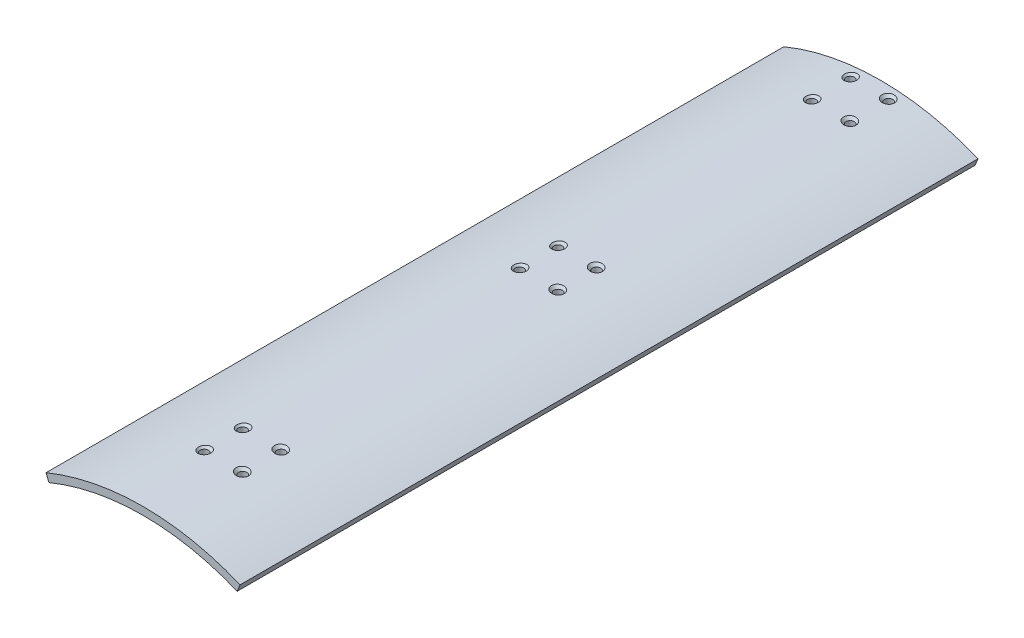
from build123d import *

# Parameters (mm, degrees)
BOSS_EXTRUDE1_DEPTH                               = 152.4
BOSS_EXTRUDE1_DEPTH_BACK                          = 152.4
CSK_FOR_4_FLAT_HEAD_MACHINE_SCREW_100_D           = 3.4544
CSK_FOR_4_FLAT_HEAD_MACHINE_SCREW_100_CSINK_D     = 5.715
CSK_FOR_4_FLAT_HEAD_MACHINE_SCREW_100_CSINK_ANGLE = 82


with BuildPart() as part:
    # Sketch1 → Boss-Extrude1 (new, two sides: drawn at the far end of the back side and taken through both)
    with BuildSketch(Plane.XY.offset(-BOSS_EXTRUDE1_DEPTH_BACK)):
        with BuildLine():
            Line((-40.09565662605267, 96.79947801886989), (-38.88063672829351, 93.86616050314657))
            ThreePointArc((-38.88063672829351, 93.86616050314657), (-3.6664e-13, 101.59999999999997), (38.88063672829282, 93.86616050314684))
            Line((38.88063672829282, 93.86616050314684), (40.095656626051976, 96.7994780188702))
            ThreePointArc((40.095656626051976, 96.7994780188702), (-3.74e-13, 104.77499999999996), (-40.09565662605267, 96.79947801886989))
        make_face()
    extrude(amount=BOSS_EXTRUDE1_DEPTH + BOSS_EXTRUDE1_DEPTH_BACK)

    # CSK for #4 Flat Head Machine Screw (100)2 (through all)
    with Locations(Plane(origin=(0, 104.77499999999993, 0), x_dir=(1, 0, 0), z_dir=(0, 1, 0))):
        with Locations((7.9375, 147.6375), (7.9375, 131.7625), (-7.9375, 131.7625), (-7.9375, 147.6375), (7.9375, 26.9875), (7.9375, 11.1125), (-7.9375, 11.1125), (-7.9375, 26.9875), (7.9375, -103.3145), (7.9375, -119.1895), (-7.9375, -119.1895), (-7.9375, -103.3145)):
            CounterSinkHole(CSK_FOR_4_FLAT_HEAD_MACHINE_SCREW_100_D / 2, CSK_FOR_4_FLAT_HEAD_MACHINE_SCREW_100_CSINK_D / 2, counter_sink_angle=CSK_FOR_4_FLAT_HEAD_MACHINE_SCREW_100_CSINK_ANGLE)


solid = part.part
